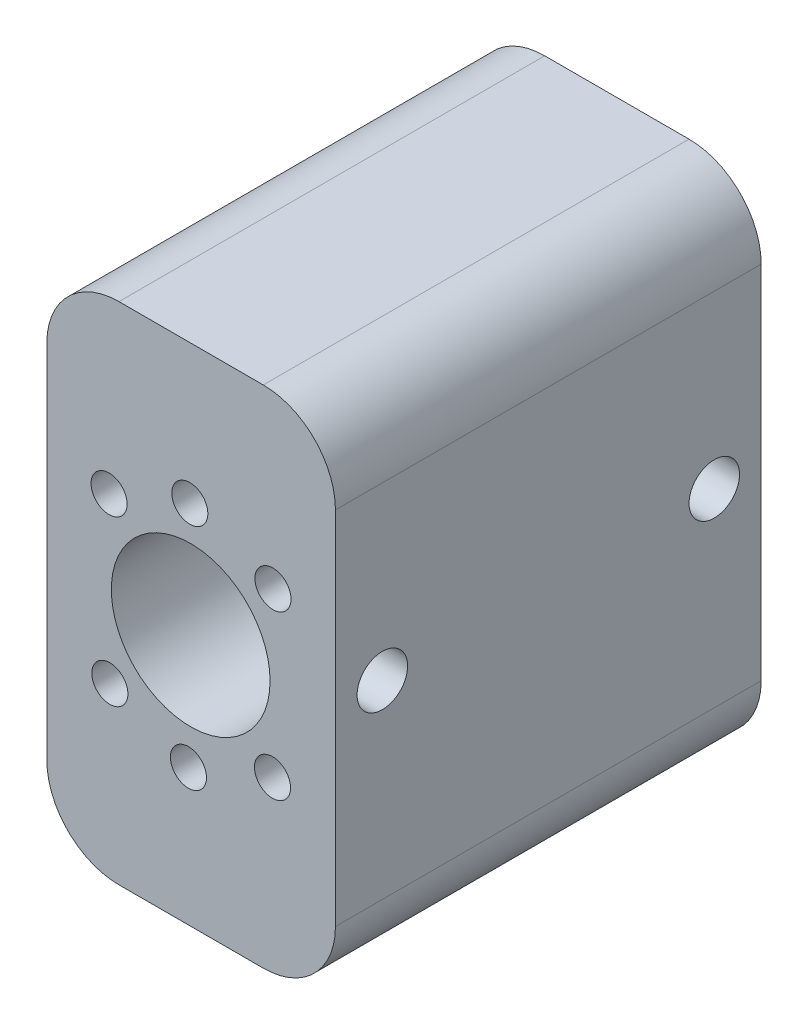
from build123d import *

# Parameters (mm, degrees)
SKETCH1_W           = 40
SKETCH1_H           = 70
BOSS_EXTRUDE1_DEPTH = 59
SKETCH2_R           = 11
SKETCH2_R_2         = 2.5
CUT_EXTRUDE1_DEPTH  = 72.504101247
SKETCH5_R           = 2.55
CUT_EXTRUDE3_DEPTH  = 5
FILLET1_R           = 10
FILLET2_R           = 10
FILLET3_R           = 10
FILLET4_R           = 10
CUT_EXTRUDE4_START  = 20.060831
SKETCH10_R          = 3.5
CUT_EXTRUDE4_DEPTH  = 5


with BuildPart() as part:
    # Sketch1 → Boss-Extrude1 (new body)
    with BuildSketch(Plane.XY):
        with Locations((0.060830656, 0.062794648)):
            Rectangle(SKETCH1_W, SKETCH1_H)
    extrude(amount=BOSS_EXTRUDE1_DEPTH)

    # Sketch2 → Cut-Extrude1 (cut, through all)
    with BuildSketch(Plane.XY):
        Circle(SKETCH2_R)
        with Locations((-11.313708499, 11.313708499)):
            Circle(SKETCH2_R_2)
        with Locations((-0.122338904, 15.759725587)):
            Circle(SKETCH2_R_2)
        with Locations((11.402693442, 11.263696484)):
            Circle(SKETCH2_R_2)
        with Locations((11.339369089, -11.406422087)):
            Circle(SKETCH2_R_2)
        with Locations((-0.312311964, -16.029099896)):
            Circle(SKETCH2_R_2)
        with Locations((-11.204100775, -11.406422087)):
            Circle(SKETCH2_R_2)
    extrude(amount=CUT_EXTRUDE1_DEPTH, mode=Mode.SUBTRACT)

    # Sketch5 → Cut-Extrude3 (cut)
    with BuildSketch(Plane.ZY.offset(19.939169344)):
        with Locations((29.5, 0.062794648)):
            Circle(SKETCH5_R)
        with Locations((39.5, 0.062794648)):
            Circle(SKETCH5_R)
        with Locations((19.5, 0.062794648)):
            Circle(SKETCH5_R)
        with Locations((29.5, 10.062794648)):
            Circle(SKETCH5_R)
        with Locations((29.5, -9.937205352)):
            Circle(SKETCH5_R)
    extrude(amount=-CUT_EXTRUDE3_DEPTH, mode=Mode.SUBTRACT)

    # Fillet1
    fillet1_edges = [part.edges().sort_by_distance(p)[0] for p in [
        (20.060830656, 35.062794648, 29.5),
    ]]
    fillet(fillet1_edges, radius=FILLET1_R)

    # Fillet2
    fillet2_edges = [part.edges().sort_by_distance(p)[0] for p in [
        (20.060830656, -34.937205352, 29.5),
    ]]
    fillet(fillet2_edges, radius=FILLET2_R)

    # Fillet3
    fillet3_edges = [part.edges().sort_by_distance(p)[0] for p in [
        (-19.939169344, -34.937205352, 29.5),
    ]]
    fillet(fillet3_edges, radius=FILLET3_R)

    # Fillet4
    fillet4_edges = [part.edges().sort_by_distance(p)[0] for p in [
        (-19.939169344, 35.062794648, 29.5),
    ]]
    fillet(fillet4_edges, radius=FILLET4_R)

    # Sketch10 → Cut-Extrude4 (cut)
    with BuildSketch(Plane(origin=(0, 0, 0), x_dir=(0, 0, -1), z_dir=(1, 0, 0)).offset(CUT_EXTRUDE4_START)):
        with Locations((-52.5, 1.34000523)):
            Circle(SKETCH10_R)
        with Locations((-6.5, 1.34000523)):
            Circle(SKETCH10_R)
    extrude(amount=-CUT_EXTRUDE4_DEPTH, mode=Mode.SUBTRACT)


solid = part.part
